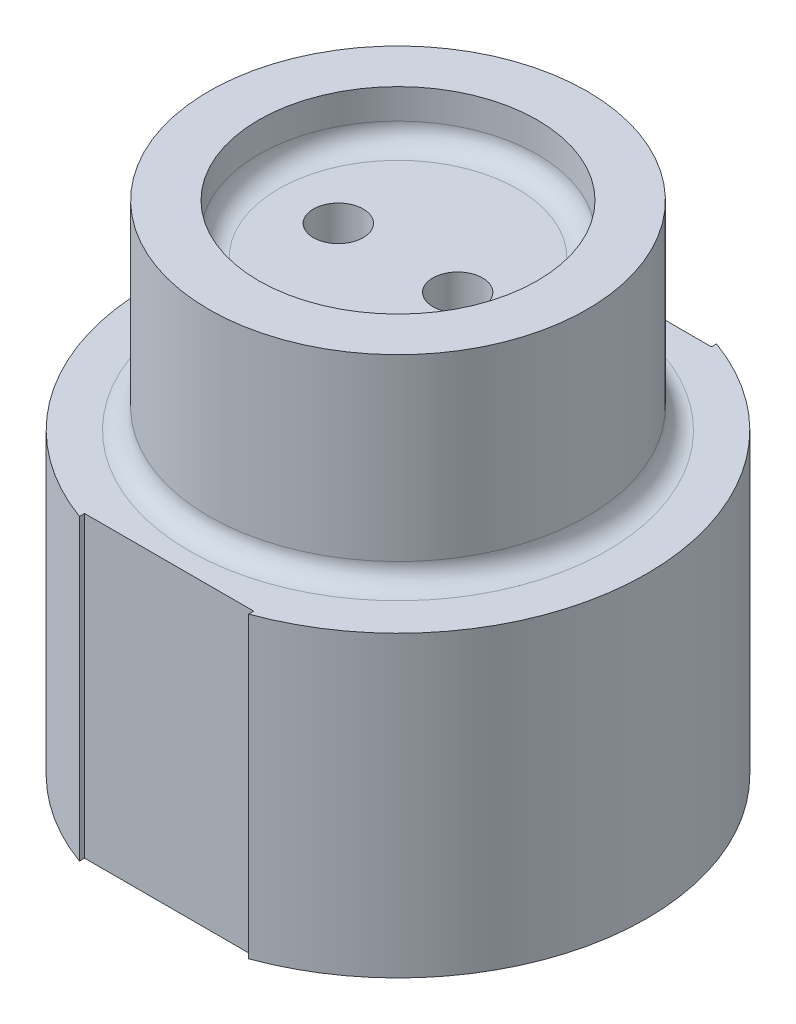
from build123d import *

# Parameters (mm, degrees)
BOSS_EXTRUDE1_START = -300
SKETCH2_R           = 1400
BOSS_EXTRUDE1_DEPTH = 300
SKETCH3_R           = 350
SKETCH3_R_2         = 250
SKETCH5_R           = 250
CUT_EXTRUDE1_DEPTH  = 5723.76157113
SKETCH6_R           = 250
CUT_EXTRUDE2_DEPTH  = 5490.990892524
SKETCH7_W           = 1700
SKETCH7_H           = 3000
CUT_EXTRUDE3_DEPTH  = 200
FILLET1_R           = 200


with BuildPart() as part:
    # Sketch1 → Revolve1 (revolve)
    with BuildSketch(Plane.XY, mode=Mode.PRIVATE) as revolve1_sk:
        Polygon((0, 0), (2500, 0), (2500, 3000), (1900, 3000), (1900, 5000), (1400, 5000), (1400, 2500), (2000, 2500), (2000, 500), (0, 500), align=None)
    revolve(revolve1_sk.sketch.rotate(Axis((0, 0, 0), (0, 1, 0)), 90), axis=Axis((0, 0, 0), (0, 1, 0)))

    # Sketch2 → Boss-Extrude1 (add)
    with BuildSketch(Plane(origin=(0, 4500, 0), x_dir=(1, 0, 0), z_dir=(0, 1, 0)).offset(BOSS_EXTRUDE1_START)):
        with Locations(Location((0, 0, 0), (0, 0, 90))):
            Circle(SKETCH2_R)
    extrude(amount=BOSS_EXTRUDE1_DEPTH)

    # Sweep1: sweep along a path in Sketch4
    with BuildLine(Plane.XY) as sweep1_path:
        Line((600, 4500), (600, 2000))
        Line((600, 2000), (1300, 2000))
        Line((1300, 2000), (1300, 0))
    # Sketch3 → Sweep1 (sweep)
    with BuildSketch(Plane(origin=(0, 4500, 0), x_dir=(1, 0, 0), z_dir=(0, 1, 0))):
        with Locations((600, 0)):
            Circle(SKETCH3_R)
        with Locations((600, 0)):
            Circle(SKETCH3_R_2, mode=Mode.SUBTRACT)
    sweep1 = sweep(path=sweep1_path.line, transition=Transition.RIGHT)

    # Sketch5 → Cut-Extrude1 (cut, through all)
    with BuildSketch(Plane(origin=(0, 500, 0), x_dir=(1, 0, 0), z_dir=(0, 1, 0))):
        with Locations((1300, 0)):
            Circle(SKETCH5_R)
    cut_extrude1 = extrude(amount=-CUT_EXTRUDE1_DEPTH, mode=Mode.SUBTRACT)

    # Sketch6 → Cut-Extrude2 (cut, through all)
    with BuildSketch(Plane.XZ.offset(-4200)):
        with Locations(Location((600, 0, 0), (0, 0, 90))):
            Circle(SKETCH6_R)
    cut_extrude2 = extrude(amount=-CUT_EXTRUDE2_DEPTH, mode=Mode.SUBTRACT)

    # Mirror2: Sweep1, Cut-Extrude1, Cut-Extrude2 across plane
    add(sweep1.mirror(Plane(origin=(0, 0, 0), x_dir=(0, 0, 1), z_dir=(1, 0, 0))))
    add(cut_extrude1.mirror(Plane(origin=(0, 0, 0), x_dir=(0, 0, 1), z_dir=(1, 0, 0))), mode=Mode.SUBTRACT)
    add(cut_extrude2.mirror(Plane(origin=(0, 0, 0), x_dir=(0, 0, 1), z_dir=(1, 0, 0))), mode=Mode.SUBTRACT)

    # Sketch7 → Cut-Extrude3 (cut)
    with BuildSketch(Plane.XY.offset(2500)):
        with Locations((0, 1500)):
            Rectangle(SKETCH7_W, SKETCH7_H)
    cut_extrude3 = extrude(amount=-CUT_EXTRUDE3_DEPTH, mode=Mode.SUBTRACT)

    # Mirror3: Cut-Extrude3 across plane
    add(cut_extrude3.mirror(Plane.XY), mode=Mode.SUBTRACT)

    # Fillet1
    fillet1_edges = [part.edges().sort_by_distance(p)[0] for p in [
        (0, 3000, 1900),
        (0, 4500, 1400),
    ]]
    fillet(fillet1_edges, radius=FILLET1_R)


solid = part.part
